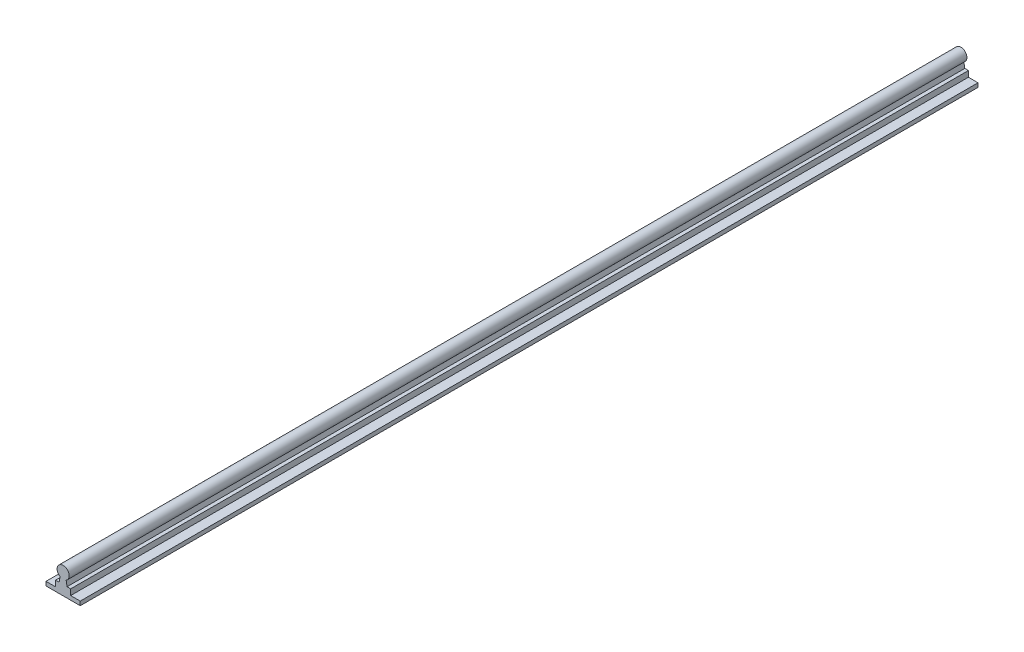
from build123d import *

# Parameters (mm, degrees)
BOSS_EXTRUDE1_DEPTH = 891.7


with BuildPart() as part:
    # Sketch1 → Boss-Extrude1 (new body)
    with BuildSketch(Plane.XY):
        with BuildLine():
            Line((21.307457755, 0), (-12.692542245, 0))
            Line((-12.692542245, 0), (-12.692542245, 4))
            Line((-12.692542245, 4), (-3.192542245, 4))
            Line((-3.192542245, 4), (-3.192542245, 9.8))
            Line((-3.192542245, 9.8), (0.390557455, 9.8))
            Line((0.390557455, 9.8), (1.307457755, 15))
            ThreePointArc((1.307457755, 15), (4.307457755, 26.196152423), (7.307457755, 15))
            Line((7.307457755, 15), (8.224358055, 9.8))
            Line((8.224358055, 9.8), (11.807457755, 9.8))
            Line((11.807457755, 9.8), (11.807457755, 4))
            Line((11.807457755, 4), (21.307457755, 4))
            Line((21.307457755, 4), (21.307457755, 0))
        make_face()
    extrude(amount=BOSS_EXTRUDE1_DEPTH)


solid = part.part
